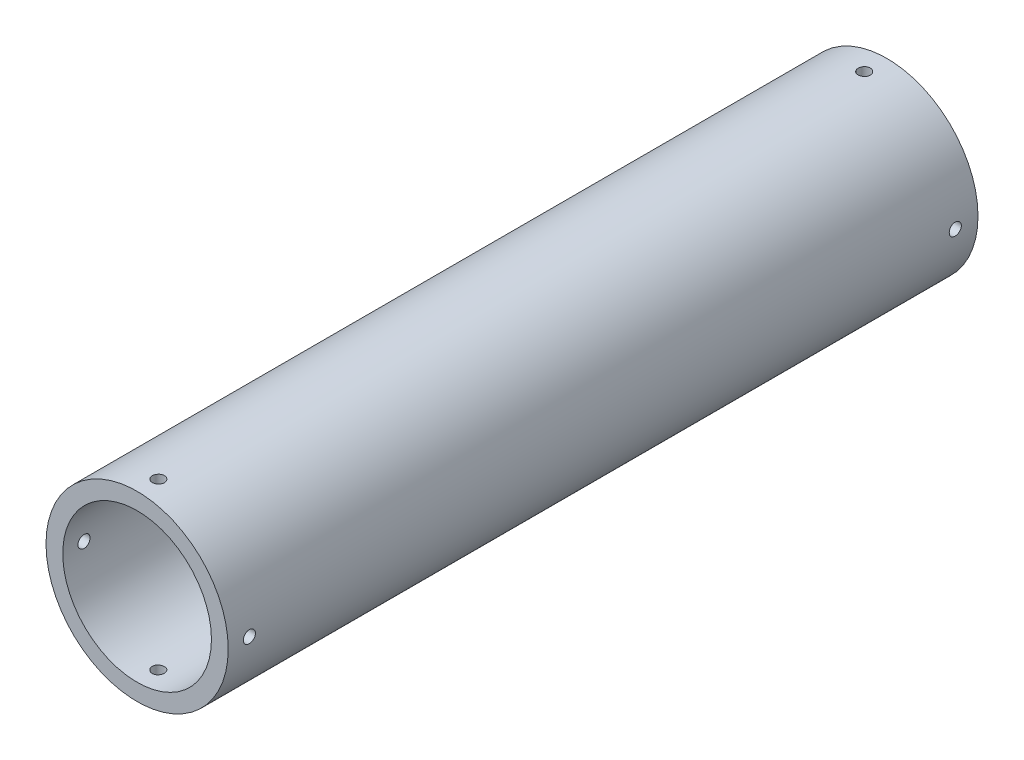
from build123d import *

# Parameters (mm, degrees)
SKETCH1_R                           = 30.099
SKETCH1_R_2                         = 24.5618
BOSS_EXTRUDE1_DEPTH                 = 247.7
F_4_0MM_DOWEL_HOLE1_D               = 4
F_4_0MM_DOWEL_HOLE1_DEPTH           = 6
F_4_0MM_DOWEL_HOLE1_TIP             = 1.201721238
F_4_0MM_DOWEL_HOLE1_ON_FACE_2_D     = 4
F_4_0MM_DOWEL_HOLE1_ON_FACE_2_DEPTH = 6
F_4_0MM_DOWEL_HOLE1_ON_FACE_2_TIP   = 1.201721238
F_4_0MM_DOWEL_HOLE1_ON_FACE_3_D     = 4
F_4_0MM_DOWEL_HOLE1_ON_FACE_3_DEPTH = 6
F_4_0MM_DOWEL_HOLE1_ON_FACE_3_TIP   = 1.201721238
F_4_0MM_DOWEL_HOLE1_ON_FACE_4_D     = 4
F_4_0MM_DOWEL_HOLE1_ON_FACE_4_DEPTH = 6
F_4_0MM_DOWEL_HOLE1_ON_FACE_4_TIP   = 1.201721238
F_4_0MM_DOWEL_HOLE2_D               = 4
F_4_0MM_DOWEL_HOLE2_DEPTH           = 6
F_4_0MM_DOWEL_HOLE2_TIP             = 1.201721238
F_4_0MM_DOWEL_HOLE2_ON_FACE_2_D     = 4
F_4_0MM_DOWEL_HOLE2_ON_FACE_2_DEPTH = 6
F_4_0MM_DOWEL_HOLE2_ON_FACE_2_TIP   = 1.201721238
F_4_0MM_DOWEL_HOLE2_ON_FACE_3_D     = 4
F_4_0MM_DOWEL_HOLE2_ON_FACE_3_DEPTH = 6
F_4_0MM_DOWEL_HOLE2_ON_FACE_3_TIP   = 1.201721238
F_4_0MM_DOWEL_HOLE2_ON_FACE_4_D     = 4
F_4_0MM_DOWEL_HOLE2_ON_FACE_4_DEPTH = 6
F_4_0MM_DOWEL_HOLE2_ON_FACE_4_TIP   = 1.201721238


with BuildPart() as part:
    # Sketch1 → Boss-Extrude1 (new body)
    with BuildSketch(Plane.XY):
        Circle(SKETCH1_R)
        Circle(SKETCH1_R_2, mode=Mode.SUBTRACT)
    extrude(amount=BOSS_EXTRUDE1_DEPTH)

    # Ø4.0mm Dowel Hole1
    with Locations(Plane(origin=(0, 30.099, 7.5), x_dir=(1, 0, 0), z_dir=(0, 1, 0))):
        with Locations((0, 0)):
            Hole(F_4_0MM_DOWEL_HOLE1_D / 2, depth=F_4_0MM_DOWEL_HOLE1_DEPTH)
            with Locations((0, 0, -(F_4_0MM_DOWEL_HOLE1_DEPTH + F_4_0MM_DOWEL_HOLE1_TIP / 2))):  # 118° drill point
                Cone(0, F_4_0MM_DOWEL_HOLE1_D / 2, F_4_0MM_DOWEL_HOLE1_TIP, mode=Mode.SUBTRACT)

    # Ø4.0mm Dowel Hole1 on face 2
    with Locations(Plane(origin=(30.099, 0, 7.5), x_dir=(0, 0, 1), z_dir=(1, 0, 0))):
        with Locations((0, 0)):
            Hole(F_4_0MM_DOWEL_HOLE1_ON_FACE_2_D / 2, depth=F_4_0MM_DOWEL_HOLE1_ON_FACE_2_DEPTH)
            with Locations((0, 0, -(F_4_0MM_DOWEL_HOLE1_ON_FACE_2_DEPTH + F_4_0MM_DOWEL_HOLE1_ON_FACE_2_TIP / 2))):  # 118° drill point
                Cone(0, F_4_0MM_DOWEL_HOLE1_ON_FACE_2_D / 2, F_4_0MM_DOWEL_HOLE1_ON_FACE_2_TIP, mode=Mode.SUBTRACT)

    # Ø4.0mm Dowel Hole1 on face 3
    with Locations(Plane(origin=(0, -30.099, 7.5), x_dir=(0, 0, -1), z_dir=(0, -1, 0))):
        with Locations((0, 0)):
            Hole(F_4_0MM_DOWEL_HOLE1_ON_FACE_3_D / 2, depth=F_4_0MM_DOWEL_HOLE1_ON_FACE_3_DEPTH)
            with Locations((0, 0, -(F_4_0MM_DOWEL_HOLE1_ON_FACE_3_DEPTH + F_4_0MM_DOWEL_HOLE1_ON_FACE_3_TIP / 2))):  # 118° drill point
                Cone(0, F_4_0MM_DOWEL_HOLE1_ON_FACE_3_D / 2, F_4_0MM_DOWEL_HOLE1_ON_FACE_3_TIP, mode=Mode.SUBTRACT)

    # Ø4.0mm Dowel Hole1 on face 4
    with Locations(Plane(origin=(-30.099, 0, 7.5), x_dir=(0, 0, -1), z_dir=(-1, 0, 0))):
        with Locations((0, 0)):
            Hole(F_4_0MM_DOWEL_HOLE1_ON_FACE_4_D / 2, depth=F_4_0MM_DOWEL_HOLE1_ON_FACE_4_DEPTH)
            with Locations((0, 0, -(F_4_0MM_DOWEL_HOLE1_ON_FACE_4_DEPTH + F_4_0MM_DOWEL_HOLE1_ON_FACE_4_TIP / 2))):  # 118° drill point
                Cone(0, F_4_0MM_DOWEL_HOLE1_ON_FACE_4_D / 2, F_4_0MM_DOWEL_HOLE1_ON_FACE_4_TIP, mode=Mode.SUBTRACT)

    # Ø4.0mm Dowel Hole2
    with Locations(Plane(origin=(0, -30.099, 240.7), x_dir=(-1, 0, 0), z_dir=(0, -1, 0))):
        with Locations((0, 0)):
            Hole(F_4_0MM_DOWEL_HOLE2_D / 2, depth=F_4_0MM_DOWEL_HOLE2_DEPTH)
            with Locations((0, 0, -(F_4_0MM_DOWEL_HOLE2_DEPTH + F_4_0MM_DOWEL_HOLE2_TIP / 2))):  # 118° drill point
                Cone(0, F_4_0MM_DOWEL_HOLE2_D / 2, F_4_0MM_DOWEL_HOLE2_TIP, mode=Mode.SUBTRACT)

    # Ø4.0mm Dowel Hole2 on face 2
    with Locations(Plane(origin=(-30.099, 0, 240.7), x_dir=(0, 0, -1), z_dir=(-1, 0, 0))):
        with Locations((0, 0)):
            Hole(F_4_0MM_DOWEL_HOLE2_ON_FACE_2_D / 2, depth=F_4_0MM_DOWEL_HOLE2_ON_FACE_2_DEPTH)
            with Locations((0, 0, -(F_4_0MM_DOWEL_HOLE2_ON_FACE_2_DEPTH + F_4_0MM_DOWEL_HOLE2_ON_FACE_2_TIP / 2))):  # 118° drill point
                Cone(0, F_4_0MM_DOWEL_HOLE2_ON_FACE_2_D / 2, F_4_0MM_DOWEL_HOLE2_ON_FACE_2_TIP, mode=Mode.SUBTRACT)

    # Ø4.0mm Dowel Hole2 on face 3
    with Locations(Plane(origin=(0, 30.099, 240.7), x_dir=(0, 0, 1), z_dir=(0, 1, 0))):
        with Locations((0, 0)):
            Hole(F_4_0MM_DOWEL_HOLE2_ON_FACE_3_D / 2, depth=F_4_0MM_DOWEL_HOLE2_ON_FACE_3_DEPTH)
            with Locations((0, 0, -(F_4_0MM_DOWEL_HOLE2_ON_FACE_3_DEPTH + F_4_0MM_DOWEL_HOLE2_ON_FACE_3_TIP / 2))):  # 118° drill point
                Cone(0, F_4_0MM_DOWEL_HOLE2_ON_FACE_3_D / 2, F_4_0MM_DOWEL_HOLE2_ON_FACE_3_TIP, mode=Mode.SUBTRACT)

    # Ø4.0mm Dowel Hole2 on face 4
    with Locations(Plane(origin=(30.099, 0, 240.7), x_dir=(0, 0, 1), z_dir=(1, 0, 0))):
        with Locations((0, 0)):
            Hole(F_4_0MM_DOWEL_HOLE2_ON_FACE_4_D / 2, depth=F_4_0MM_DOWEL_HOLE2_ON_FACE_4_DEPTH)
            with Locations((0, 0, -(F_4_0MM_DOWEL_HOLE2_ON_FACE_4_DEPTH + F_4_0MM_DOWEL_HOLE2_ON_FACE_4_TIP / 2))):  # 118° drill point
                Cone(0, F_4_0MM_DOWEL_HOLE2_ON_FACE_4_D / 2, F_4_0MM_DOWEL_HOLE2_ON_FACE_4_TIP, mode=Mode.SUBTRACT)


solid = part.part
